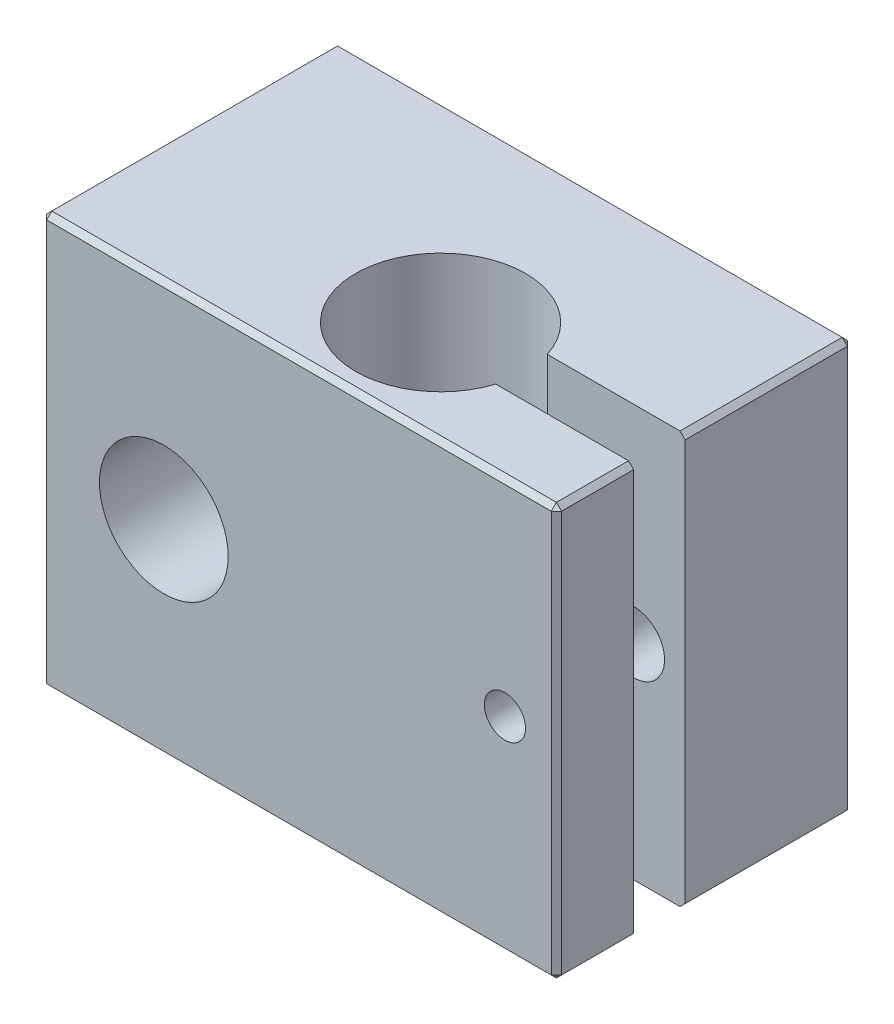
from build123d import *

# Parameters (mm, degrees)
ESQUISSE1_W             = 20
ESQUISSE1_H             = 16
BOSS_EXTRU_1_DEPTH      = 11.5
TROU_TARAUD_M61_D       = 5
PER_AGE1_D              = 1
PER_AGE1_DEPTH          = 4.5
PER_AGE1_CBORE_D        = 2
PER_AGE1_CBORE_DEPTH    = 2
TROU_TARAUD_M2_51_D     = 2.05
TROU_TARAUD_M2_51_DEPTH = 4.5
TROU_TARAUD_M2_51_TIP   = 0.615882135
D_GAGEMENT_M61_D        = 6.6
ESQUISSE10_W            = 11.487199582
ESQUISSE10_H            = 2
ENL_V_MAT_EXTRU_1_DEPTH = 25.916109247
TROU_TARAUD_M21_D       = 1.6
TROU_TARAUD_M21_DEPTH   = 3
D_GAGEMENT_M21_D        = 2.4
D_GAGEMENT_M21_DEPTH    = 6.5
CHANFREIN1_SIZE         = 0.2


with BuildPart() as part:
    # Esquisse1 → Boss.-Extru.1 (new body)
    with BuildSketch(Plane.XY):
        with Locations((5.25, 0)):
            Rectangle(ESQUISSE1_W, ESQUISSE1_H)
    extrude(amount=BOSS_EXTRU_1_DEPTH)

    # Trou taraudé M61 (through all)
    with Locations(Plane.XY.offset(11.5)):
        with Locations((0, 0)):
            Hole(TROU_TARAUD_M61_D / 2)

    # Perçage1
    with Locations(Plane(origin=(0, -8, 0), x_dir=(-1, 0, 0), z_dir=(0, -1, 0))):
        with Locations((2.25, -9)):
            CounterBoreHole(PER_AGE1_D / 2, PER_AGE1_CBORE_D / 2, PER_AGE1_CBORE_DEPTH, depth=PER_AGE1_DEPTH)

    # Trou taraudé M2.51
    with Locations(Plane(origin=(0, -8, 0), x_dir=(-1, 0, 0), z_dir=(0, -1, 0))):
        with Locations((1.25, -6.5)):
            Hole(TROU_TARAUD_M2_51_D / 2, depth=TROU_TARAUD_M2_51_DEPTH)
            with Locations((0, 0, -(TROU_TARAUD_M2_51_DEPTH + TROU_TARAUD_M2_51_TIP / 2))):  # 118° drill point
                Cone(0, TROU_TARAUD_M2_51_D / 2, TROU_TARAUD_M2_51_TIP, mode=Mode.SUBTRACT)

    # Dégagement M61 (through all)
    with Locations(Plane(origin=(0, -8, 0), x_dir=(-1, 0, 0), z_dir=(0, -1, 0))):
        with Locations((-6.75, -7.5)):
            Hole(D_GAGEMENT_M61_D / 2)

    # Esquisse10 → Enlèv. mat.-Extru.1 (cut, through all)
    with BuildSketch(Plane.XZ.offset(8)):
        with Locations((12.493599791, 7.5)):
            Rectangle(ESQUISSE10_W, ESQUISSE10_H)
    extrude(amount=-ENL_V_MAT_EXTRU_1_DEPTH, mode=Mode.SUBTRACT)

    # Trou taraudé M21
    with Locations(Plane.XY.offset(11.5)):
        with Locations((13.25, 0)):
            Hole(TROU_TARAUD_M21_D / 2, depth=TROU_TARAUD_M21_DEPTH)

    # Dégagement M21
    with Locations(Plane(origin=(0, 0, 0), x_dir=(-1, 0, 0), z_dir=(0, 0, -1))):
        with Locations((-13.25, 0)):
            Hole(D_GAGEMENT_M21_D / 2, depth=D_GAGEMENT_M21_DEPTH)

    # Chanfrein1
    chanfrein1_edges = [part.edges().sort_by_distance(p)[0] for p in [
        (15.25, 0, 11.5),
        (5.25, 8, 11.5),
        (15.25, 8, 3.25),
        (15.25, -8, 3.25),
        (-4.75, 0, 11.5),
        (5.25, 8, 0),
        (15.25, 0, 0),
        (5.25, -8, 0),
        (-4.75, 0, 0),
        (5.25, -8, 11.5),
        (-4.75, 8, 5.75),
        (15.25, 8, 10),
        (15.25, -8, 10),
        (-4.75, -8, 5.75),
    ]]
    chamfer(chanfrein1_edges, length=CHANFREIN1_SIZE)


solid = part.part
